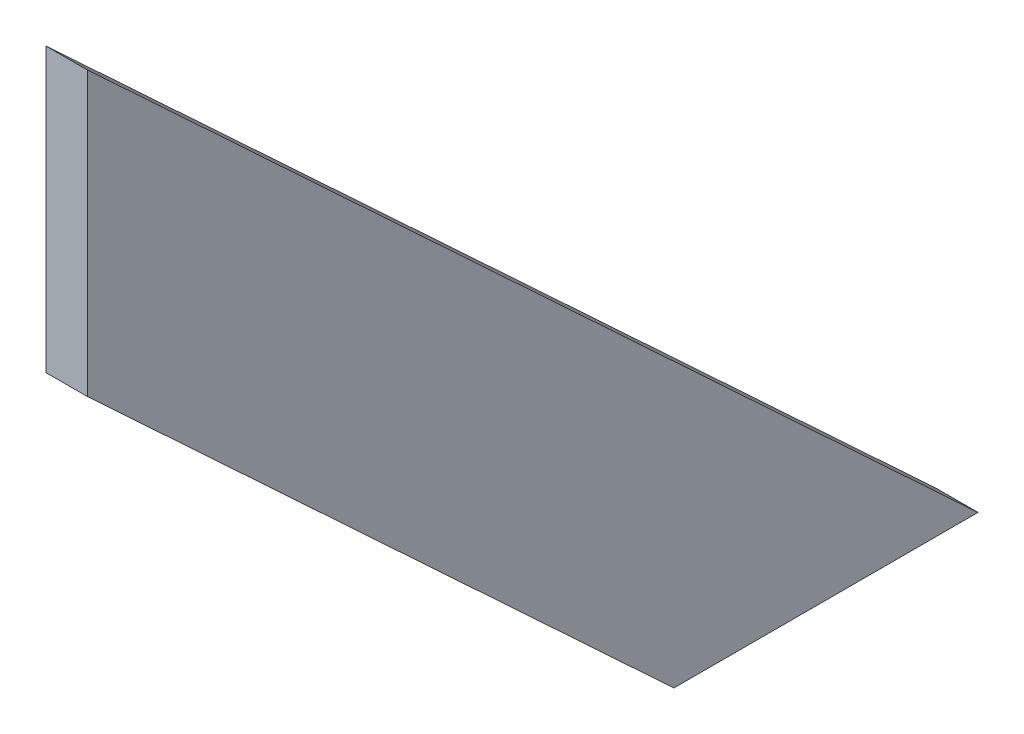
from build123d import *

# Parameters (mm, degrees)
BOSS_EXTRUDE1_DEPTH = 2


with BuildPart() as part:
    # Sketch1 → Boss-Extrude1 (new body)
    with BuildSketch(Plane(origin=(0, 0, 0), x_dir=(0, 0, -1), z_dir=(1, 0, 0))):
        Polygon((28.31795314, 0), (43, 0), (0, 40), (0, 26.342281991), align=None)
    extrude(amount=BOSS_EXTRUDE1_DEPTH)


solid = part.part
